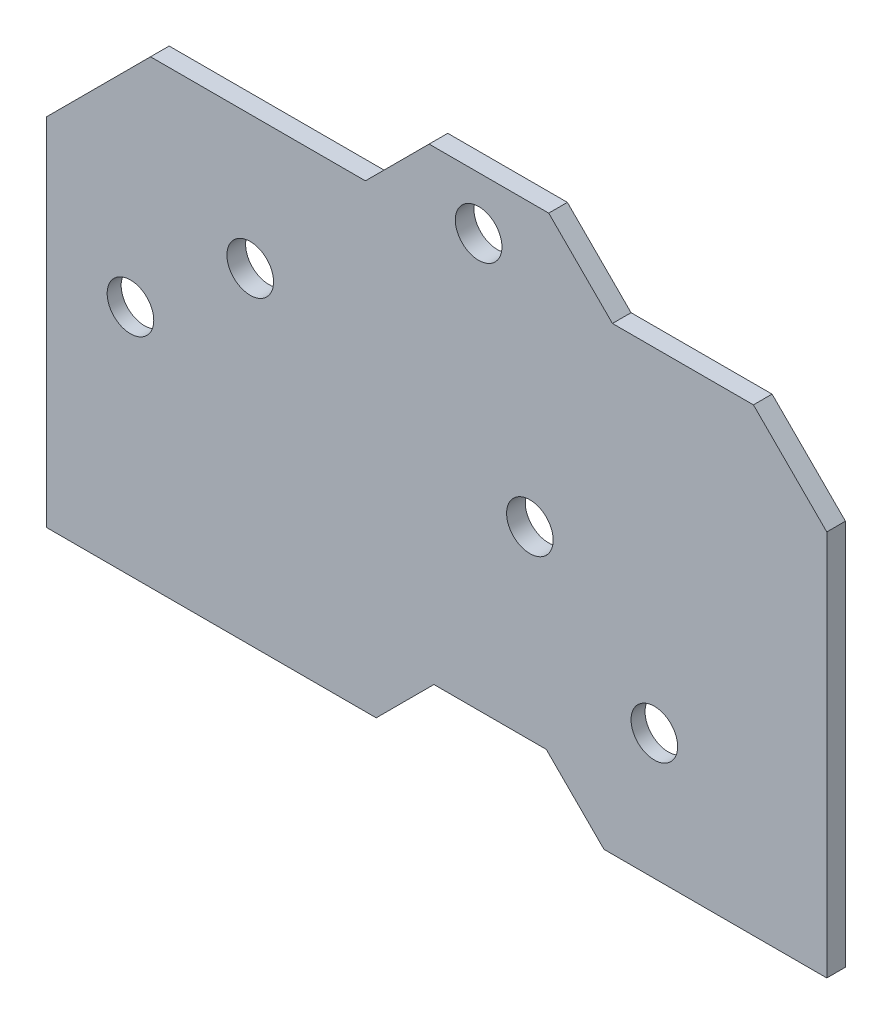
from build123d import *

# Parameters (mm, degrees)
SKETCH_1_R      = 5.2
SKETCH_1_R_2    = 2.5
EXTRUDE_1_DEPTH = 2
EXTRUDE_START   = -1.5
SKETCH_3_R      = 5.2
SKETCH_3_R_2    = 2.5
EXTRUDE_3_DEPTH = 1.5


with BuildPart() as part:
    # 스케치1 → 보스-돌출1 (new body)
    with BuildSketch(Plane.XY):
        Polygon((17.655171042, 21.115026673), (32.779698935, 21.115026673), (40.649680384, 13.245045225), (40.649680384, -28.196867314), (16.748789391, -28.196867314), (10.556633431, -22.004711354), (-1.494033315, -22.004711354), (-7.686189276, -28.196867314), (-43.049187557, -28.196867314), (-43.049187557, 9.964172757), (-31.898333641, 21.115026673), (-8.845568875, 21.115026673), (-2.011604239, 27.94899131), (10.821206405, 27.94899131), align=None)
        with Locations((22.149680384, -14.696867314)):
            Circle(SKETCH_1_R, mode=Mode.SUBTRACT)
        with Locations((-34.049187557, -3.196867314)):
            Circle(SKETCH_1_R, mode=Mode.SUBTRACT)
        with Locations((8.800246413, -2.196867314)):
            Circle(SKETCH_1_R_2, mode=Mode.SUBTRACT)
        with Locations((3.300246413, 22.303132686)):
            Circle(SKETCH_1_R_2, mode=Mode.SUBTRACT)
        with Locations((-21.199753587, 6.803132686)):
            Circle(SKETCH_1_R_2, mode=Mode.SUBTRACT)
    extrude(amount=EXTRUDE_1_DEPTH)

    # 스케치3 → 보스-돌출3 (add)
    # profile 1 of 2: a face of its own
    with BuildSketch(Plane.XY.offset(2).offset(EXTRUDE_START)):
        with Locations((-34.049187557, -3.196867314)):
            Circle(SKETCH_3_R)
        with Locations((-34.049187557, -3.196867314)):
            Circle(SKETCH_3_R_2, mode=Mode.SUBTRACT)
    # profile 2 of 2: a face of its own
    with BuildSketch(Plane.XY.offset(2).offset(EXTRUDE_START)):
        with Locations((22.149680384, -14.696867314)):
            Circle(SKETCH_3_R)
        with Locations((22.149680384, -14.696867314)):
            Circle(SKETCH_3_R_2, mode=Mode.SUBTRACT)
    extrude(amount=EXTRUDE_3_DEPTH)


solid = part.part
